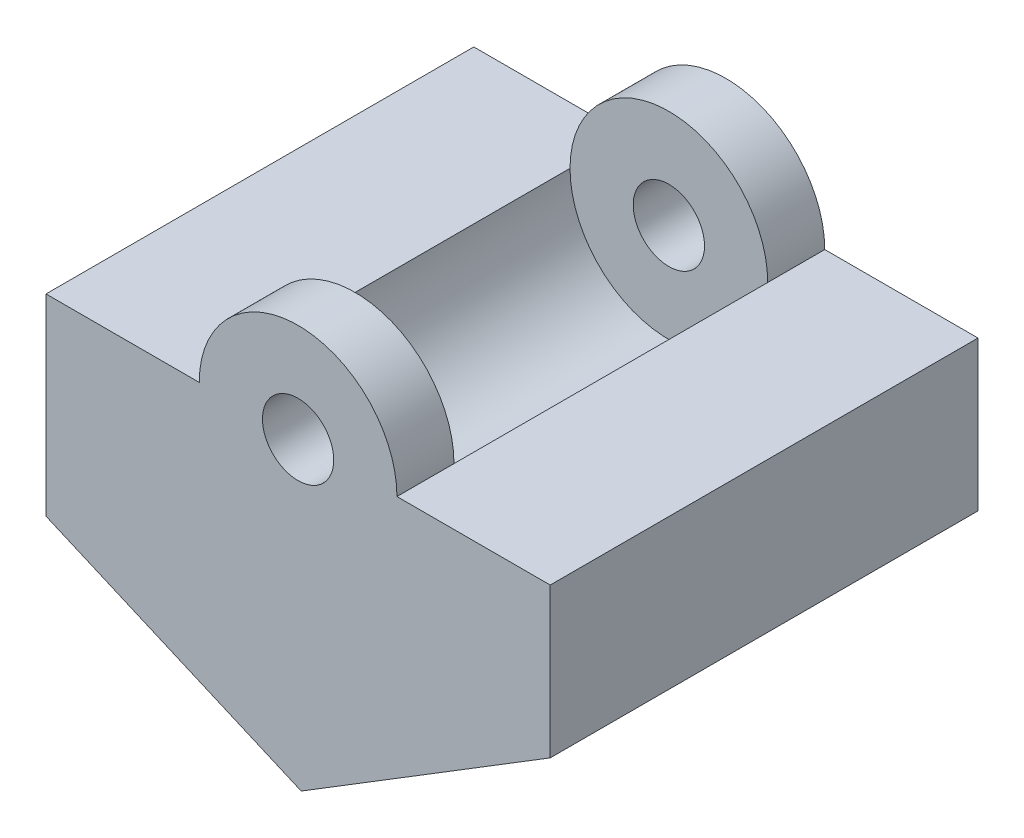
from build123d import *

# Parameters (mm, degrees)
BOSS_EXTRUDE1_DEPTH = 60
CUT_EXTRUDE1_START  = -52
SKETCH3_R           = 13.864092281
CUT_EXTRUDE1_DEPTH  = 44
SKETCH4_R           = 5
CUT_EXTRUDE2_DEPTH  = 90.75812925
SKETCH5_R           = 4.5
CUT_EXTRUDE3_DEPTH  = 15


with BuildPart() as part:
    # Sketch1 → Boss-Extrude1 (new body)
    with BuildSketch(Plane.XY):
        with BuildLine():
            Line((0, 0), (-35.793601182, 15.486061941))
            Line((-35.793601182, 15.486061941), (-35.793601182, 42.486061941))
            Line((-35.793601182, 42.486061941), (-14.301302797, 42.486061941))
            ThreePointArc((-14.301302797, 42.486061941), (-0.437210516, 56.350154222), (13.426881764, 42.486061941))
            Line((13.426881764, 42.486061941), (34.919180149, 42.486061941))
            Line((34.919180149, 42.486061941), (34.919180149, 21.486061941))
            Line((34.919180149, 21.486061941), (0, 0))
        make_face()
    extrude(amount=BOSS_EXTRUDE1_DEPTH)

    # Sketch3 → Cut-Extrude1 (cut)
    with BuildSketch(Plane.XY.offset(60).offset(CUT_EXTRUDE1_START)):
        with Locations((-0.437210516, 42.486061941)):
            Circle(SKETCH3_R)
    extrude(amount=CUT_EXTRUDE1_DEPTH, mode=Mode.SUBTRACT)

    # Sketch4 → Cut-Extrude2 (cut, through all)
    with BuildSketch(Plane.XY.offset(60)):
        with Locations((-0.437210516, 42.486061941)):
            Circle(SKETCH4_R)
    extrude(amount=-CUT_EXTRUDE2_DEPTH, mode=Mode.SUBTRACT)

    # Sketch5 → Cut-Extrude3 (cut)
    with BuildSketch(Plane(origin=(0, 0, 0), x_dir=(0.9177846456818411, -0.3970785113181741, 0), z_dir=(-0.3970785113181742, -0.9177846456818413, 0))):
        with Locations((-29, 51)):
            Circle(SKETCH5_R)
        with Locations((-29, 9)):
            Circle(SKETCH5_R)
    extrude(amount=-CUT_EXTRUDE3_DEPTH, mode=Mode.SUBTRACT)


solid = part.part
